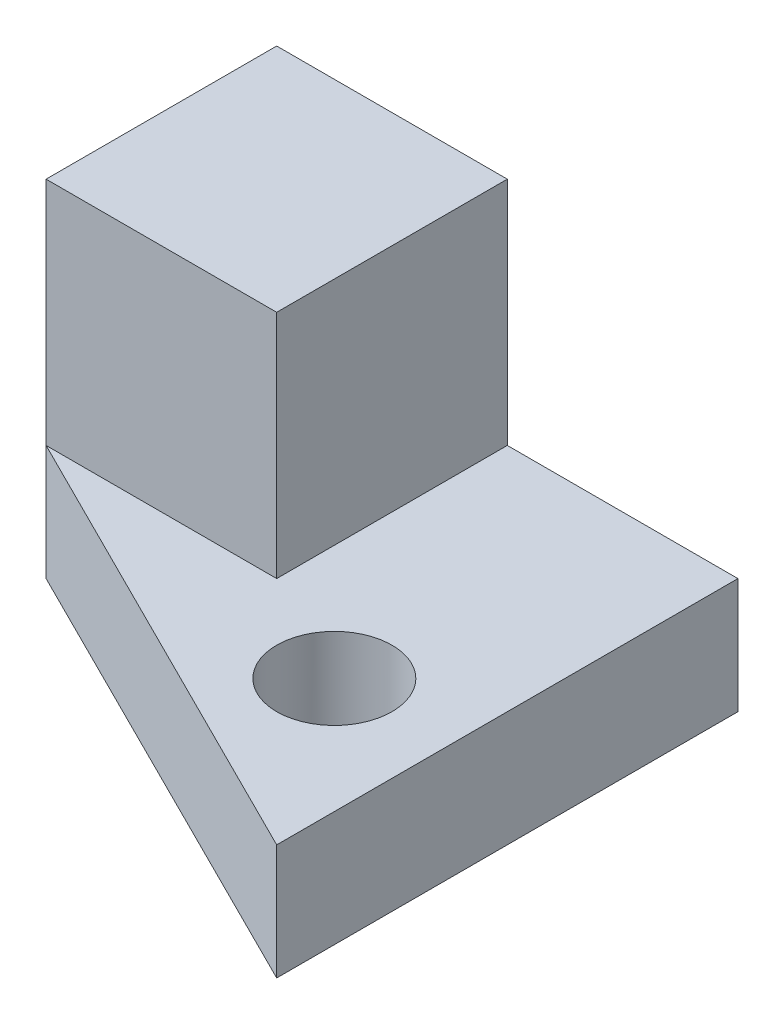
from build123d import *

# Parameters (mm, degrees)
SKETCH1_W           = 1016
SKETCH1_H           = 1016
BOSS_EXTRUDE1_DEPTH = 1016
CUT_EXTRUDE1_DEPTH  = 1016
CUT_EXTRUDE2_DEPTH  = 762
SKETCH4_W           = 508
SKETCH4_H           = 254
CUT_EXTRUDE3_DEPTH  = 762
SKETCH5_R           = 127
CUT_EXTRUDE4_DEPTH  = 762


with BuildPart() as part:
    # Sketch1 → Boss-Extrude1 (new body)
    with BuildSketch(Plane(origin=(0, 0, 0), x_dir=(1, 0, 0), z_dir=(0, 1, 0))):
        with Locations((508, 508)):
            Rectangle(SKETCH1_W, SKETCH1_H)
    extrude(amount=BOSS_EXTRUDE1_DEPTH)

    # Sketch2 → Cut-Extrude1 (cut)
    with BuildSketch(Plane(origin=(0, 1016, 0), x_dir=(1, 0, 0), z_dir=(0, 1, 0))):
        Polygon((0, 0), (1016, 0), (0, 508), align=None)
    extrude(amount=-CUT_EXTRUDE1_DEPTH, mode=Mode.SUBTRACT)

    # Sketch3 → Cut-Extrude2 (cut)
    with BuildSketch(Plane(origin=(0, 1016, 0), x_dir=(1, 0, 0), z_dir=(0, 1, 0))):
        Polygon((0, 508), (508, 508), (508, 1016), (1016, 1016), (1016, 0), align=None)
    extrude(amount=-CUT_EXTRUDE2_DEPTH, mode=Mode.SUBTRACT)

    # Sketch4 → Cut-Extrude3 (cut)
    with BuildSketch(Plane.XY.offset(-508)):
        with Locations((254, 889)):
            Rectangle(SKETCH4_W, SKETCH4_H)
    extrude(amount=-CUT_EXTRUDE3_DEPTH, mode=Mode.SUBTRACT)

    # Sketch5 → Cut-Extrude4 (cut)
    with BuildSketch(Plane(origin=(0, 254, 0), x_dir=(1, 0, 0), z_dir=(0, 1, 0))):
        with Locations(Location((762, 381, 0), (0, 0, 270))):
            Circle(SKETCH5_R)
    extrude(amount=-CUT_EXTRUDE4_DEPTH, mode=Mode.SUBTRACT)


solid = part.part
